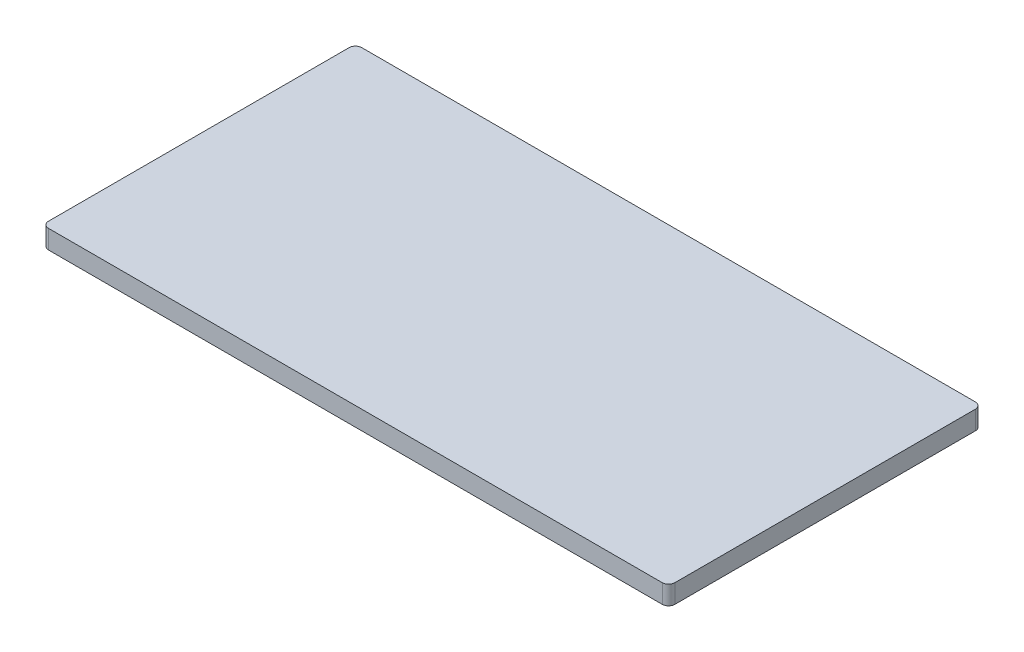
from build123d import *

# Parameters (mm, degrees)
SKETCH1_W           = 100
SKETCH1_H           = 50
BOSS_EXTRUDE1_DEPTH = 3
FILLET1_R           = 1


with BuildPart() as part:
    # Sketch1 → Boss-Extrude1 (new body)
    with BuildSketch(Plane(origin=(0, 0, 0), x_dir=(1, 0, 0), z_dir=(0, 1, 0))):
        with Locations((50, 25)):
            Rectangle(SKETCH1_W, SKETCH1_H)
    extrude(amount=BOSS_EXTRUDE1_DEPTH)

    # Fillet1
    fillet1_edges = [part.edges().sort_by_distance(p)[0] for p in [
        (0, 1.5, -50),
        (100, 1.5, -50),
        (100, 1.5, 0),
        (0, 1.5, 0),
    ]]
    fillet(fillet1_edges, radius=FILLET1_R)


solid = part.part
